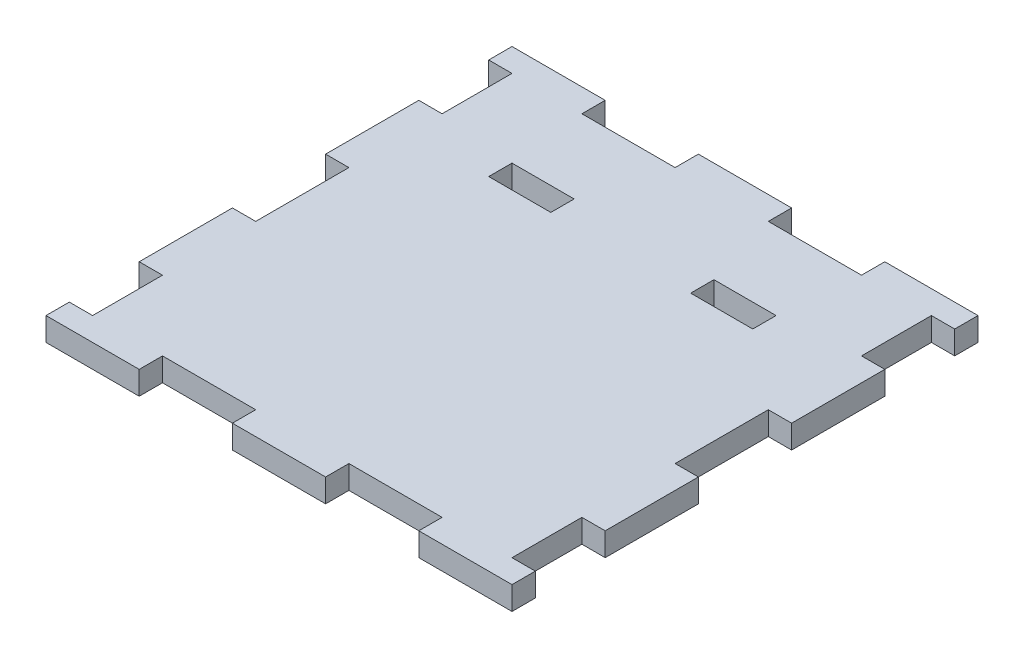
from build123d import *

# Parameters (mm, degrees)
SKETCH1_W           = 190.5
SKETCH1_H           = 190.5
BOSS_EXTRUDE1_DEPTH = 9.525
SKETCH2_W           = 38.1
SKETCH2_H           = 9.525
CUT_EXTRUDE1_DEPTH  = 9.525
SKETCH3_W           = 38.1
SKETCH3_H           = 9.525
CUT_EXTRUDE2_DEPTH  = 9.525
SKETCH4_W           = 9.525
SKETCH4_H           = 28.575
CUT_EXTRUDE3_DEPTH  = 9.525
SKETCH5_W           = 9.525
SKETCH5_H           = 38.1
CUT_EXTRUDE4_DEPTH  = 9.525
SKETCH6_W           = 9.525
SKETCH6_H           = 28.575
CUT_EXTRUDE5_DEPTH  = 9.525
SKETCH7_W           = 38.1
SKETCH7_H           = 9.525
CUT_EXTRUDE6_DEPTH  = 9.525
SKETCH8_W           = 38.1
SKETCH8_H           = 9.525
CUT_EXTRUDE7_DEPTH  = 9.525
SKETCH9_W           = 9.525
SKETCH9_H           = 28.575
CUT_EXTRUDE8_DEPTH  = 38.1
SKETCH10_W          = 9.525
SKETCH10_H          = 38.1
CUT_EXTRUDE9_DEPTH  = 9.525
SKETCH11_W          = 9.525
SKETCH11_H          = 28.575
CUT_EXTRUDE10_DEPTH = 9.525
SKETCH12_W          = 25.4
SKETCH12_H          = 9.525
CUT_EXTRUDE11_DEPTH = 12.7


with BuildPart() as part:
    # Sketch1 → Boss-Extrude1 (new body)
    with BuildSketch(Plane(origin=(0, 0, 0), x_dir=(1, 0, 0), z_dir=(0, 1, 0))):
        with Locations((61.628840928, 48.799714441)):
            Rectangle(SKETCH1_W, SKETCH1_H)
    extrude(amount=BOSS_EXTRUDE1_DEPTH)

    # Sketch2 → Cut-Extrude1 (cut)
    with BuildSketch(Plane(origin=(0, 9.525, 0), x_dir=(1, 0, 0), z_dir=(0, 1, 0))):
        with Locations((99.728840928, -41.687785559)):
            Rectangle(SKETCH2_W, SKETCH2_H)
    extrude(amount=-CUT_EXTRUDE1_DEPTH, mode=Mode.SUBTRACT)

    # Sketch3 → Cut-Extrude2 (cut)
    with BuildSketch(Plane(origin=(0, 9.525, 0), x_dir=(1, 0, 0), z_dir=(0, 1, 0))):
        with Locations((23.528840928, -41.687785559)):
            Rectangle(SKETCH3_W, SKETCH3_H)
    extrude(amount=-CUT_EXTRUDE2_DEPTH, mode=Mode.SUBTRACT)

    # Sketch4 → Cut-Extrude3 (cut)
    with BuildSketch(Plane(origin=(0, 9.525, 0), x_dir=(1, 0, 0), z_dir=(0, 1, 0))):
        with Locations((152.116340928, -22.637785559)):
            Rectangle(SKETCH4_W, SKETCH4_H)
    extrude(amount=-CUT_EXTRUDE3_DEPTH, mode=Mode.SUBTRACT)

    # Sketch5 → Cut-Extrude4 (cut)
    with BuildSketch(Plane(origin=(0, 9.525, 0), x_dir=(1, 0, 0), z_dir=(0, 1, 0))):
        with Locations((152.116340928, 48.799714441)):
            Rectangle(SKETCH5_W, SKETCH5_H)
    extrude(amount=-CUT_EXTRUDE4_DEPTH, mode=Mode.SUBTRACT)

    # Sketch6 → Cut-Extrude5 (cut)
    with BuildSketch(Plane(origin=(0, 9.525, 0), x_dir=(1, 0, 0), z_dir=(0, 1, 0))):
        with Locations((152.116340928, 120.237214441)):
            Rectangle(SKETCH6_W, SKETCH6_H)
    extrude(amount=-CUT_EXTRUDE5_DEPTH, mode=Mode.SUBTRACT)

    # Sketch7 → Cut-Extrude6 (cut)
    with BuildSketch(Plane(origin=(0, 9.525, 0), x_dir=(1, 0, 0), z_dir=(0, 1, 0))):
        with Locations((99.728840928, 139.287214441)):
            Rectangle(SKETCH7_W, SKETCH7_H)
    extrude(amount=-CUT_EXTRUDE6_DEPTH, mode=Mode.SUBTRACT)

    # Sketch8 → Cut-Extrude7 (cut)
    with BuildSketch(Plane(origin=(0, 9.525, 0), x_dir=(1, 0, 0), z_dir=(0, 1, 0))):
        with Locations((23.528840928, 139.287214441)):
            Rectangle(SKETCH8_W, SKETCH8_H)
    extrude(amount=-CUT_EXTRUDE7_DEPTH, mode=Mode.SUBTRACT)

    # Sketch9 → Cut-Extrude8 (cut)
    with BuildSketch(Plane(origin=(0, 9.525, 0), x_dir=(1, 0, 0), z_dir=(0, 1, 0))):
        with Locations((-28.858659072, 120.237214441)):
            Rectangle(SKETCH9_W, SKETCH9_H)
    extrude(amount=-CUT_EXTRUDE8_DEPTH, mode=Mode.SUBTRACT)

    # Sketch10 → Cut-Extrude9 (cut)
    with BuildSketch(Plane(origin=(0, 9.525, 0), x_dir=(1, 0, 0), z_dir=(0, 1, 0))):
        with Locations((-28.858659072, 48.799714441)):
            Rectangle(SKETCH10_W, SKETCH10_H)
    extrude(amount=-CUT_EXTRUDE9_DEPTH, mode=Mode.SUBTRACT)

    # Sketch11 → Cut-Extrude10 (cut)
    with BuildSketch(Plane(origin=(0, 9.525, 0), x_dir=(1, 0, 0), z_dir=(0, 1, 0))):
        with Locations((-28.858659072, -22.637785559)):
            Rectangle(SKETCH11_W, SKETCH11_H)
    extrude(amount=-CUT_EXTRUDE10_DEPTH, mode=Mode.SUBTRACT)

    # Sketch12 → Cut-Extrude11 (cut)
    with BuildSketch(Plane(origin=(0, 9.525, 0), x_dir=(1, 0, 0), z_dir=(0, 1, 0))):
        with Locations((20.353840928, 98.012214441)):
            Rectangle(SKETCH12_W, SKETCH12_H)
        with Locations((102.903840928, 98.012214441)):
            Rectangle(SKETCH12_W, SKETCH12_H)
    extrude(amount=-CUT_EXTRUDE11_DEPTH, mode=Mode.SUBTRACT)


solid = part.part
